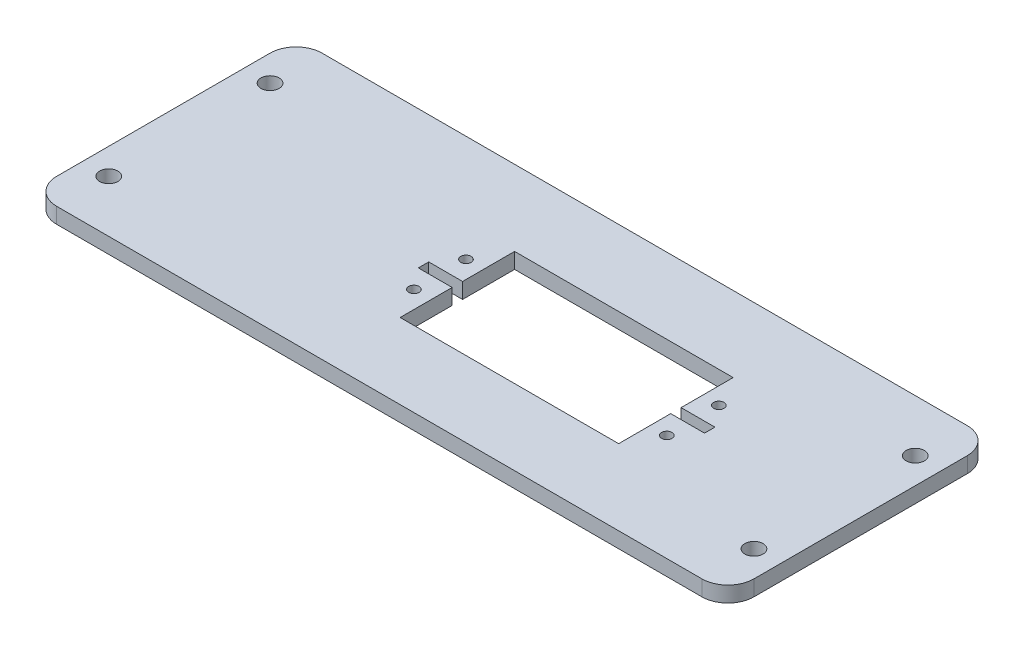
from build123d import *

# Parameters (mm, degrees)
SKETCH_1_W          = 134
SKETCH_1_H          = 51
EXTRUDE_1_DEPTH     = 3
CUT_EXTRUDE_1_REACH = 73.751
SKETCH_2_R          = 1.75
CUT_EXTRUDE_2_REACH = 73.751
SKETCH_3_R          = 1
FILLET_1_R          = 5


with BuildPart() as part:
    # 스케치1 → 보스-돌출1 (new body)
    with BuildSketch(Plane(origin=(0, 0, 0), x_dir=(1, 0, 0), z_dir=(0, 1, 0))):
        Rectangle(SKETCH_1_W, SKETCH_1_H)
    extrude(amount=EXTRUDE_1_DEPTH)

    # 스케치2 → 컷-돌출1 (cut, up to next)
    with BuildSketch(Plane(origin=(0, 3, 0), x_dir=(1, 0, 0), z_dir=(0, 1, 0)), mode=Mode.PRIVATE) as cut_extrude_1_sk1:
        with Locations(Location((-62, 15.5, 0), (0, 0, 270))):
            Circle(SKETCH_2_R)
    cut_extrude_1_tool1 = extrude(cut_extrude_1_sk1.sketch, amount=-CUT_EXTRUDE_1_REACH, mode=Mode.PRIVATE) & part.part
    # 스케치2 → 컷-돌출1 (cut, up to next)
    with BuildSketch(Plane(origin=(0, 3, 0), x_dir=(1, 0, 0), z_dir=(0, 1, 0)), mode=Mode.PRIVATE) as cut_extrude_1_sk2:
        with Locations(Location((-62, -15.5, 0), (0, 0, 270))):
            Circle(SKETCH_2_R)
    cut_extrude_1_tool2 = extrude(cut_extrude_1_sk2.sketch, amount=-CUT_EXTRUDE_1_REACH, mode=Mode.PRIVATE) & part.part
    # 스케치2 → 컷-돌출1 (cut, up to next)
    with BuildSketch(Plane(origin=(0, 3, 0), x_dir=(1, 0, 0), z_dir=(0, 1, 0)), mode=Mode.PRIVATE) as cut_extrude_1_sk3:
        with Locations(Location((62, 15.5, 0), (0, 0, 270))):
            Circle(SKETCH_2_R)
    cut_extrude_1_tool3 = extrude(cut_extrude_1_sk3.sketch, amount=-CUT_EXTRUDE_1_REACH, mode=Mode.PRIVATE) & part.part
    # 스케치2 → 컷-돌출1 (cut, up to next)
    with BuildSketch(Plane(origin=(0, 3, 0), x_dir=(1, 0, 0), z_dir=(0, 1, 0)), mode=Mode.PRIVATE) as cut_extrude_1_sk4:
        with Locations(Location((62, -15.5, 0), (0, 0, 270))):
            Circle(SKETCH_2_R)
    cut_extrude_1_tool4 = extrude(cut_extrude_1_sk4.sketch, amount=-CUT_EXTRUDE_1_REACH, mode=Mode.PRIVATE) & part.part
    add(cut_extrude_1_tool1.solids().sort_by_distance((-62, 3, -15.5))[0], mode=Mode.SUBTRACT)
    add(cut_extrude_1_tool2.solids().sort_by_distance((-62, 3, 15.5))[0], mode=Mode.SUBTRACT)
    add(cut_extrude_1_tool3.solids().sort_by_distance((62, 3, -15.5))[0], mode=Mode.SUBTRACT)
    add(cut_extrude_1_tool4.solids().sort_by_distance((62, 3, 15.5))[0], mode=Mode.SUBTRACT)

    # 스케치3 → 컷-돌출2 (cut, up to next)
    with BuildSketch(Plane(origin=(0, 3, 0), x_dir=(1, 0, 0), z_dir=(0, 1, 0)), mode=Mode.PRIVATE) as cut_extrude_2_sk1:
        with Locations(Location((-13.85, 5, 0), (0, 0, 270))):
            Circle(SKETCH_3_R)
    cut_extrude_2_tool1 = extrude(cut_extrude_2_sk1.sketch, amount=-CUT_EXTRUDE_2_REACH, mode=Mode.PRIVATE) & part.part
    # 스케치3 → 컷-돌출2 (cut, up to next)
    with BuildSketch(Plane(origin=(0, 3, 0), x_dir=(1, 0, 0), z_dir=(0, 1, 0)), mode=Mode.PRIVATE) as cut_extrude_2_sk2:
        with Locations(Location((-13.85, -5, 0), (0, 0, 270))):
            Circle(SKETCH_3_R)
    cut_extrude_2_tool2 = extrude(cut_extrude_2_sk2.sketch, amount=-CUT_EXTRUDE_2_REACH, mode=Mode.PRIVATE) & part.part
    # 스케치3 → 컷-돌출2 (cut, up to next)
    with BuildSketch(Plane(origin=(0, 3, 0), x_dir=(1, 0, 0), z_dir=(0, 1, 0)), mode=Mode.PRIVATE) as cut_extrude_2_sk3:
        with Locations(Location((34.75, 5, 0), (0, 0, 270))):
            Circle(SKETCH_3_R)
    cut_extrude_2_tool3 = extrude(cut_extrude_2_sk3.sketch, amount=-CUT_EXTRUDE_2_REACH, mode=Mode.PRIVATE) & part.part
    # 스케치3 → 컷-돌출2 (cut, up to next)
    with BuildSketch(Plane(origin=(0, 3, 0), x_dir=(1, 0, 0), z_dir=(0, 1, 0)), mode=Mode.PRIVATE) as cut_extrude_2_sk4:
        with Locations(Location((34.75, -5, 0), (0, 0, 270))):
            Circle(SKETCH_3_R)
    cut_extrude_2_tool4 = extrude(cut_extrude_2_sk4.sketch, amount=-CUT_EXTRUDE_2_REACH, mode=Mode.PRIVATE) & part.part
    # 스케치3 → 컷-돌출2 (cut, up to next)
    with BuildSketch(Plane(origin=(0, 3, 0), x_dir=(1, 0, 0), z_dir=(0, 1, 0)), mode=Mode.PRIVATE) as cut_extrude_2_sk5:
        Polygon((-10.5, 11), (31.5, 11), (31.5, 1), (38, 1), (38, -1), (31.5, -1), (31.5, -11), (-10.5, -11), (-10.5, -1), (-17, -1), (-17, 1), (-10.5, 1), align=None)
    cut_extrude_2_tool5 = extrude(cut_extrude_2_sk5.sketch, amount=-CUT_EXTRUDE_2_REACH, mode=Mode.PRIVATE) & part.part
    add(cut_extrude_2_tool1.solids().sort_by_distance((-13.85, 3, -5))[0], mode=Mode.SUBTRACT)
    add(cut_extrude_2_tool2.solids().sort_by_distance((-13.85, 3, 5))[0], mode=Mode.SUBTRACT)
    add(cut_extrude_2_tool3.solids().sort_by_distance((34.75, 3, -5))[0], mode=Mode.SUBTRACT)
    add(cut_extrude_2_tool4.solids().sort_by_distance((34.75, 3, 5))[0], mode=Mode.SUBTRACT)
    add(cut_extrude_2_tool5.solids().sort_by_distance((10.5, 3, 0))[0], mode=Mode.SUBTRACT)

    # 필렛1
    fillet_1_edges = [part.edges().sort_by_distance(p)[0] for p in [
        (67, 1.5, 25.5),
        (-67, 1.5, 25.5),
        (-67, 1.5, -25.5),
        (67, 1.5, -25.5),
    ]]
    fillet(fillet_1_edges, radius=FILLET_1_R)


solid = part.part
